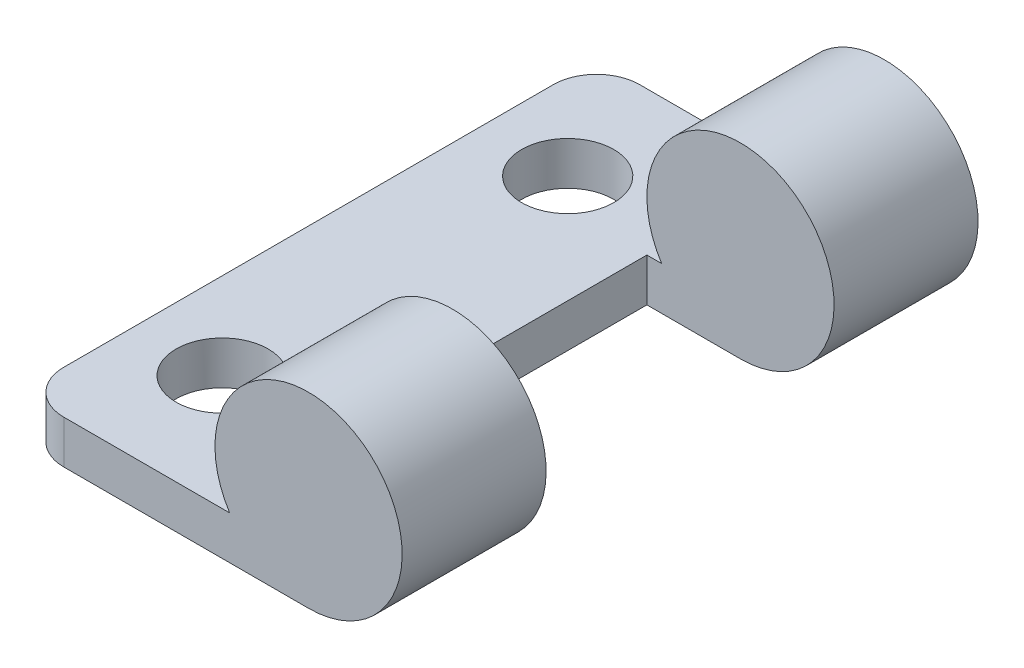
from build123d import *

# Parameters (mm, degrees)
EXTRUDE_1_DEPTH          = 10
CUT_EXTRUDE_1_DEPTH      = 16
CUT_EXTRUDE_1_DEPTH_BACK = 16
SKETCH_2_R               = 1.6
SKETCH_2_W               = 6.5
SKETCH_2_H               = 10
FILLET_1_R               = 1.5


with BuildPart() as part:
    # 草图1 → 凸台-拉伸1 (new, symmetric)
    with BuildSketch(Plane.XY):
        with BuildLine():
            Line((0, -3.25), (-10, -3.25))
            Line((-10, -3.25), (-10, -1.75))
            Line((-10, -1.75), (-2.738612788, -1.75))
            ThreePointArc((-2.738612788, -1.75), (1.5612495, 2.850438563), (0, -3.25))
        make_face()
    extrude(amount=EXTRUDE_1_DEPTH, both=True)

    # 草图2 → 切除-拉伸1 (cut, two sides: drawn at the far end of the back side and taken through both)
    with BuildSketch(Plane(origin=(0, -1.75, 0), x_dir=(1, 0, 0), z_dir=(0, 1, 0)).offset(-CUT_EXTRUDE_1_DEPTH_BACK)):
        with Locations(Location((-7, -6, 0), (0, 0, 270))):
            Circle(SKETCH_2_R)
        with Locations(Location((-7, 6, 0), (0, 0, 90))):
            Circle(SKETCH_2_R)
        Rectangle(SKETCH_2_W, SKETCH_2_H)
    extrude(amount=CUT_EXTRUDE_1_DEPTH + CUT_EXTRUDE_1_DEPTH_BACK, mode=Mode.SUBTRACT)

    # 圆角1
    fillet_1_edges = [part.edges().sort_by_distance(p)[0] for p in [
        (-10, -2.5, 10),
        (-10, -2.5, -10),
    ]]
    fillet(fillet_1_edges, radius=FILLET_1_R)


solid = part.part
